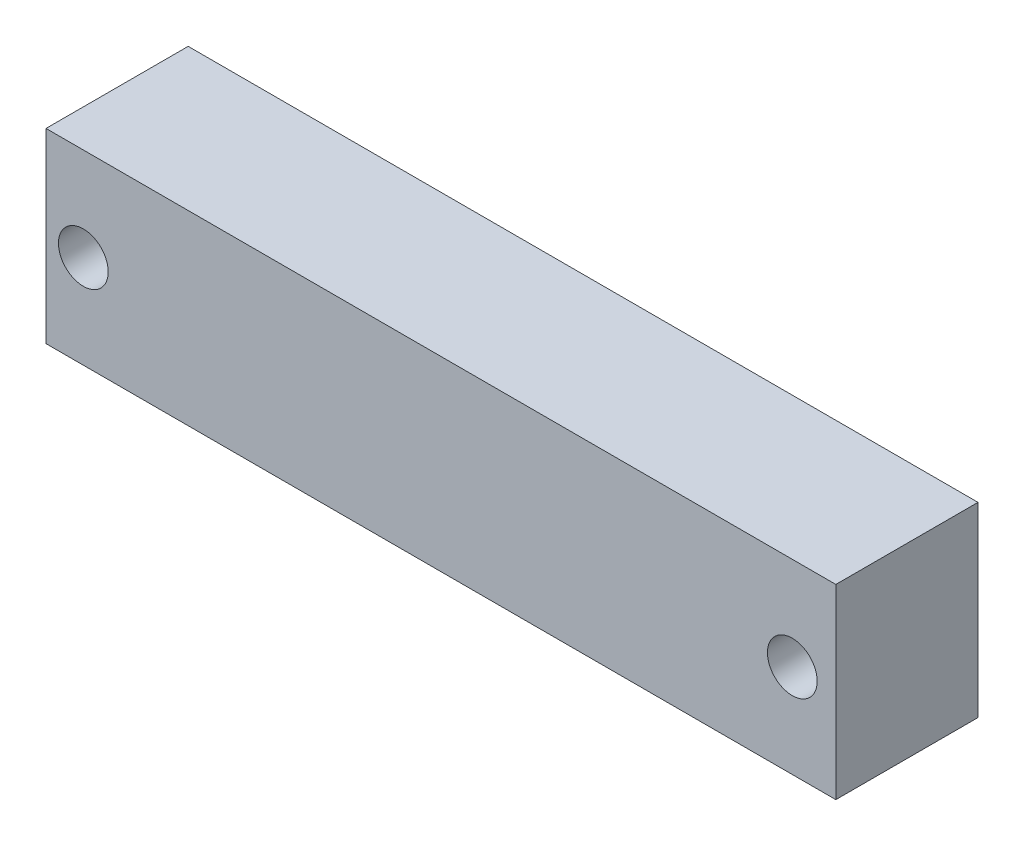
from build123d import *

# Parameters (mm, degrees)
SKETCH1_W           = 63.5
SKETCH1_H           = 14.986
BOSS_EXTRUDE1_DEPTH = 11.43
SKETCH2_R           = 2
CUT_EXTRUDE3_DEPTH  = 20


with BuildPart() as part:
    # Sketch1 → Boss-Extrude1 (new body)
    with BuildSketch(Plane.XY):
        with Locations((-52.194689379, -13.806398798)):
            Rectangle(SKETCH1_W, SKETCH1_H)
    extrude(amount=BOSS_EXTRUDE1_DEPTH)

    # Sketch2 → Cut-Extrude3 (cut)
    with BuildSketch(Plane.XY.offset(11.43)):
        with Locations((-80.944689379, -13.806398798)):
            Circle(SKETCH2_R)
        with Locations((-23.944689379, -13.806398798)):
            Circle(SKETCH2_R)
    extrude(amount=-CUT_EXTRUDE3_DEPTH, mode=Mode.SUBTRACT)


solid = part.part
